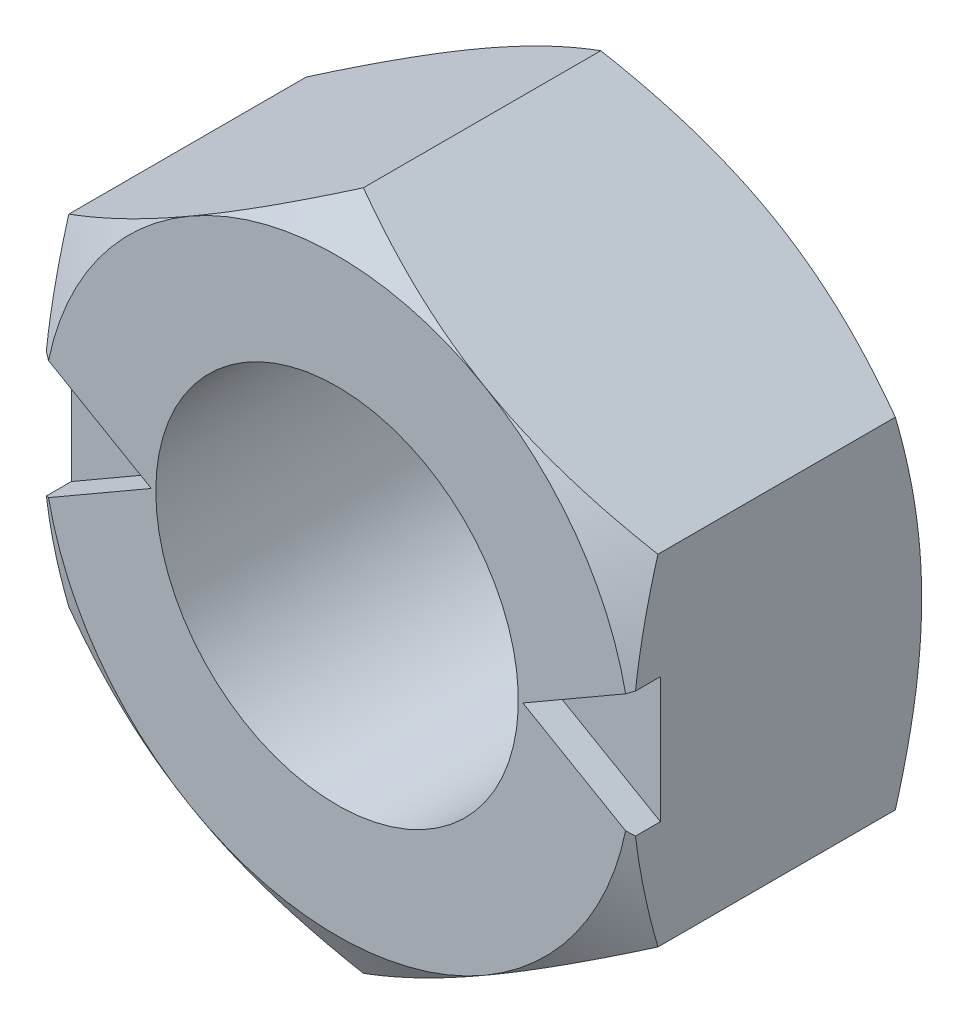
from build123d import *

# Parameters (mm, degrees)
EXTRUDE1_DEPTH      = 3.2
EXTRUDE1_DEPTH_BACK = 3.2
SKETCH2_OUTSIDE_W   = 63.558
SKETCH2_OUTSIDE_H   = 65.57
SKETCH2_OUTSIDE_R   = 6.5
CUT_EXTRUDE1_DEPTH  = 12.812846115
CUT_EXTRUDE1_DRAFT  = 60
SKETCH3_OUTSIDE_W   = 63.558
SKETCH3_OUTSIDE_H   = 65.57
SKETCH3_OUTSIDE_R   = 6.5
CUT_EXTRUDE2_DEPTH  = 12.812846115
CUT_EXTRUDE2_DRAFT  = 60
SKETCH4_R           = 4
CUT_EXTRUDE3_DEPTH  = 12.812846115
CUT_EXTRUDE7_DEPTH  = 0.635


with BuildPart() as part:
    # Sketch1 → Extrude1 (new, two sides: drawn at the far end of the back side and taken through both)
    with BuildSketch(Plane.XY.offset(-EXTRUDE1_DEPTH_BACK)):
        Polygon((0, 7.505553499), (-6.5, 3.75277675), (-6.5, -3.75277675), (0, -7.505553499), (6.5, -3.75277675), (6.5, 3.75277675), align=None)
    extrude(amount=EXTRUDE1_DEPTH + EXTRUDE1_DEPTH_BACK)


with BuildPart() as cut_extrude1_tool:
    # Sketch2 outside → Cut-Extrude1 (with draft: the straight prism first)
    with BuildSketch(Plane(origin=(0, 0, 3.2), x_dir=(-1, 0, 0), z_dir=(0, 0, -1))):
        Rectangle(SKETCH2_OUTSIDE_W, SKETCH2_OUTSIDE_H)
        Circle(SKETCH2_OUTSIDE_R, mode=Mode.SUBTRACT)
    extrude(amount=CUT_EXTRUDE1_DEPTH)
    # Cut-Extrude1: the draft: its side faces are tilted about the plane it starts from
    cut_extrude1_sides = [cut_extrude1_tool.faces().sort_by_distance(p)[0] for p in [
        (0, -32.785, -3.206423057),
        (-31.779, 0, -3.206423057),
        (0, 32.785, -3.206423057),
        (31.779, 0, -3.206423057),
        (6.5, 0, -3.206423057),
    ]]
    draft(cut_extrude1_sides, Plane(origin=(0, 0, 3.2), x_dir=(-1, 0, 0), z_dir=(0, 0, -1)), CUT_EXTRUDE1_DRAFT)


with BuildPart() as part_1:
    add(part.part)

    # Cut-Extrude1: cut by cut_extrude1_tool
    add(cut_extrude1_tool.part, mode=Mode.SUBTRACT)


with BuildPart() as cut_extrude2_tool:
    # Sketch3 outside → Cut-Extrude2 (with draft: the straight prism first)
    with BuildSketch(Plane.XY.offset(-3.2)):
        Rectangle(SKETCH3_OUTSIDE_W, SKETCH3_OUTSIDE_H)
        Circle(SKETCH3_OUTSIDE_R, mode=Mode.SUBTRACT)
    extrude(amount=CUT_EXTRUDE2_DEPTH)
    # Cut-Extrude2: the draft: its side faces are tilted about the plane it starts from
    cut_extrude2_sides = [cut_extrude2_tool.faces().sort_by_distance(p)[0] for p in [
        (0, -32.785, 3.206423057),
        (31.779, 0, 3.206423057),
        (0, 32.785, 3.206423057),
        (-31.779, 0, 3.206423057),
        (-6.5, 0, 3.206423057),
    ]]
    draft(cut_extrude2_sides, Plane.XY.offset(-3.2), CUT_EXTRUDE2_DRAFT)


with BuildPart() as part_2:
    add(part_1.part)

    # Cut-Extrude2: cut by cut_extrude2_tool
    add(cut_extrude2_tool.part, mode=Mode.SUBTRACT)

    # Sketch4 → Cut-Extrude3 (cut, through all)
    with BuildSketch(Plane(origin=(0, 0, -3.2), x_dir=(-1, 0, 0), z_dir=(0, 0, -1))):
        Circle(SKETCH4_R)
    extrude(amount=-CUT_EXTRUDE3_DEPTH, mode=Mode.SUBTRACT)

    # Sketch12 → Cut-Extrude7 (cut)
    with BuildSketch(Plane.XY.offset(3.2)):
        Polygon((-4.1, 0), (-6.5, 1.385640646), (-6.5, -1.385640646), align=None)
        Polygon((4.1, 0), (6.5, -1.385640646), (6.5, 1.385640646), align=None)
    extrude(amount=-CUT_EXTRUDE7_DEPTH, mode=Mode.SUBTRACT)


solid = part_2.part
